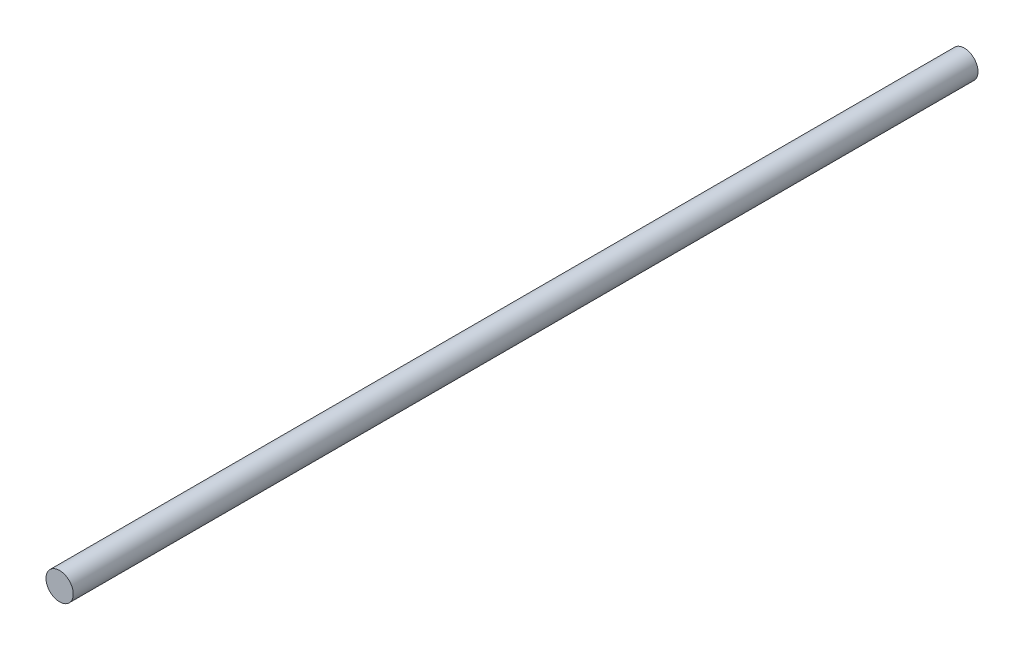
from build123d import *

# Parameters (mm, degrees)
SKETCH1_R      = 3.175
EXTRUDE1_DEPTH = 210.82


with BuildPart() as part:
    # Sketch1 → Extrude1 (new body)
    with BuildSketch(Plane.XY):
        Circle(SKETCH1_R)
    extrude(amount=EXTRUDE1_DEPTH)


solid = part.part
